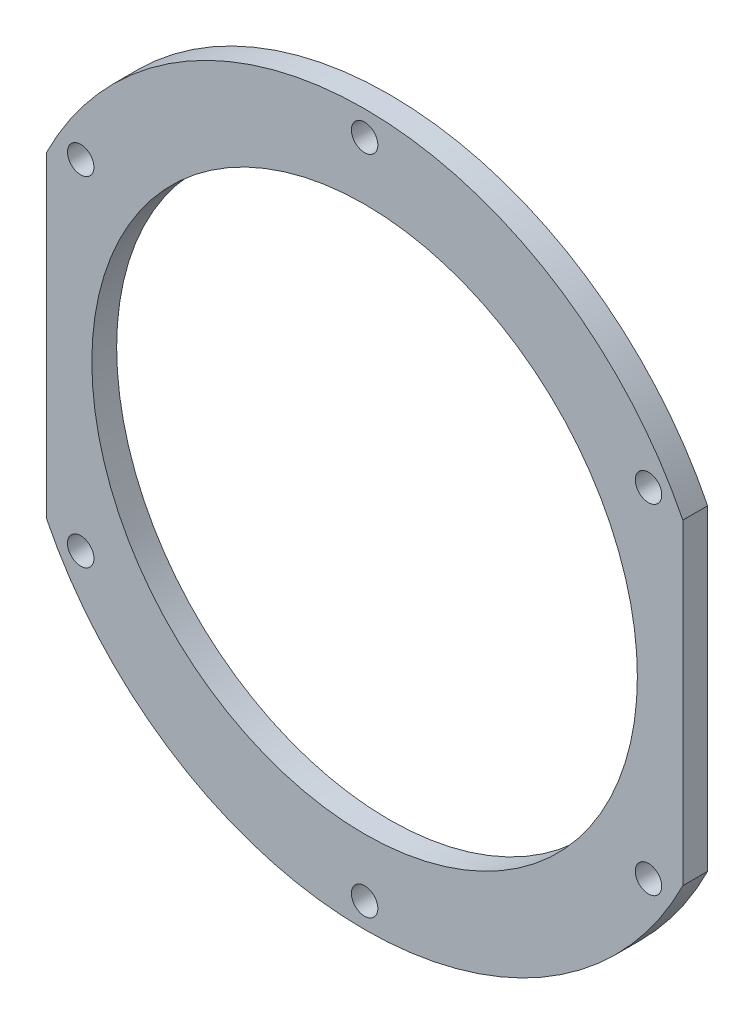
from build123d import *

# Parameters (mm, degrees)
SKIZZE1_R                        = 33
AUFSATZ_LINEAR_AUSTRAGEN1_DEPTH  = 3
F_3_2_3_2_DURCHMESSER_BOHRUNG1_D = 3.2


with BuildPart() as part:
    # Skizze1 → Aufsatz-Linear austragen1 (new body)
    with BuildSketch(Plane.XY):
        with BuildLine():
            Line((-38.5, -19.150718002), (-38.5, 19.150718002))
            ThreePointArc((-38.5, 19.150718002), (0, 43), (38.5, 19.150718002))
            Line((38.5, 19.150718002), (38.5, -19.150718002))
            ThreePointArc((38.5, -19.150718002), (0, -43), (-38.5, -19.150718002))
        make_face()
        Circle(SKIZZE1_R, mode=Mode.SUBTRACT)
    extrude(amount=AUFSATZ_LINEAR_AUSTRAGEN1_DEPTH)

    # Ø3.2 (3.2) Durchmesser Bohrung1 (through all)
    with Locations(Plane.XY.offset(3)):
        with Locations((-34.347488991, 20.5), (0, 40), (0, -40), (34.347488991, -20.5), (34.347488991, 20.5), (-34.347488991, -20.5)):
            Hole(F_3_2_3_2_DURCHMESSER_BOHRUNG1_D / 2)


solid = part.part
